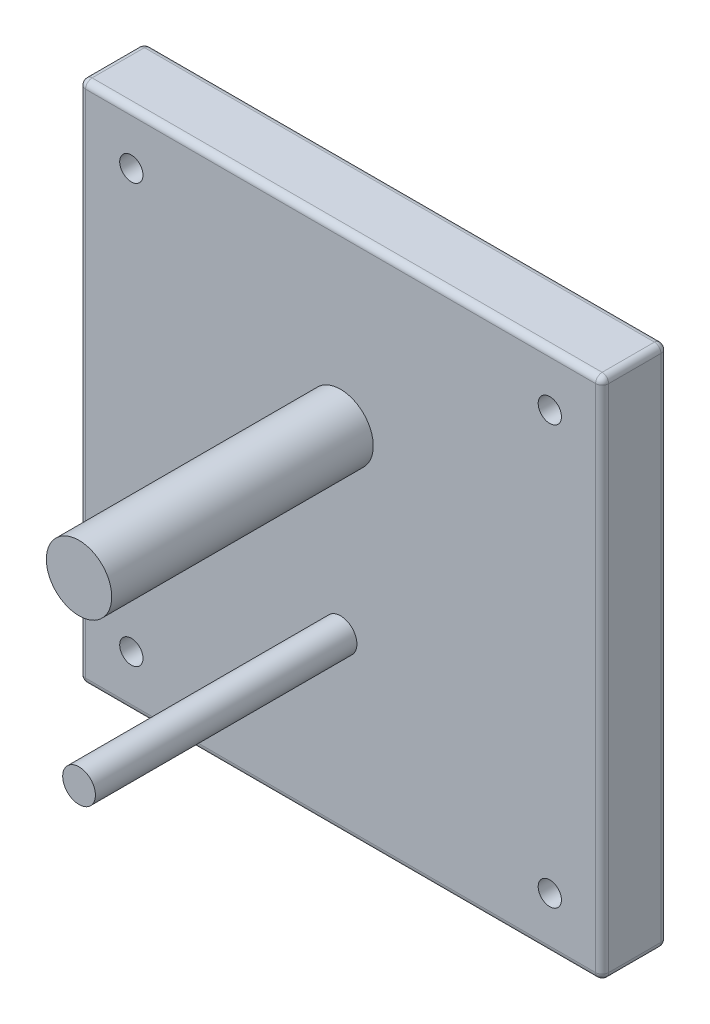
from build123d import *

# Parameters (mm, degrees)
SKETCH1_W             = 50.8
SKETCH1_H             = 50.8
BOSS_EXTRUDE1_DEPTH   = 6.35
SKETCH2_R             = 1.5875
SKETCH2_R_2           = 3.175
BOSS_EXTRUDE2_DEPTH   = 25.4
F_4_40_TAPPED_HOLE1_D = 2.2606
FILLET1_R             = 0.635


with BuildPart() as part:
    # Sketch1 → Boss-Extrude1 (new body)
    with BuildSketch(Plane(origin=(0, 0, 0), x_dir=(0, 1, 0), z_dir=(0, 0, 1))):
        Rectangle(SKETCH1_W, SKETCH1_H)
    extrude(amount=BOSS_EXTRUDE1_DEPTH)

    # Sketch2 → Boss-Extrude2 (add)
    with BuildSketch(Plane.XY.offset(6.35)):
        with Locations(Location((0, -8.73125, 0), (0, 0, 180))):
            Circle(SKETCH2_R)
        with Locations(Location((0, 8.73125, 0), (0, 0, 180))):
            Circle(SKETCH2_R_2)
    extrude(amount=BOSS_EXTRUDE2_DEPTH)

    # #4-40 Tapped Hole1 (through all)
    with Locations(Plane.XY.offset(6.35)):
        with Locations((-20.32, -20.32), (-20.32, 20.32), (20.32, 20.32), (20.32, -20.32)):
            Hole(F_4_40_TAPPED_HOLE1_D / 2)

    # Fillet1
    fillet1_edges = [part.edges().sort_by_distance(p)[0] for p in [
        (0, -25.4, 6.35),
        (25.4, 0, 6.35),
        (0, 25.4, 6.35),
        (25.4, 0, 0),
        (0, -25.4, 0),
        (-25.4, 0, 0),
        (0, 25.4, 0),
        (25.4, 25.4, 3.175),
        (25.4, -25.4, 3.175),
        (-25.4, -25.4, 3.175),
        (-25.4, 25.4, 3.175),
        (-25.4, 0, 6.35),
    ]]
    fillet(fillet1_edges, radius=FILLET1_R)


solid = part.part
